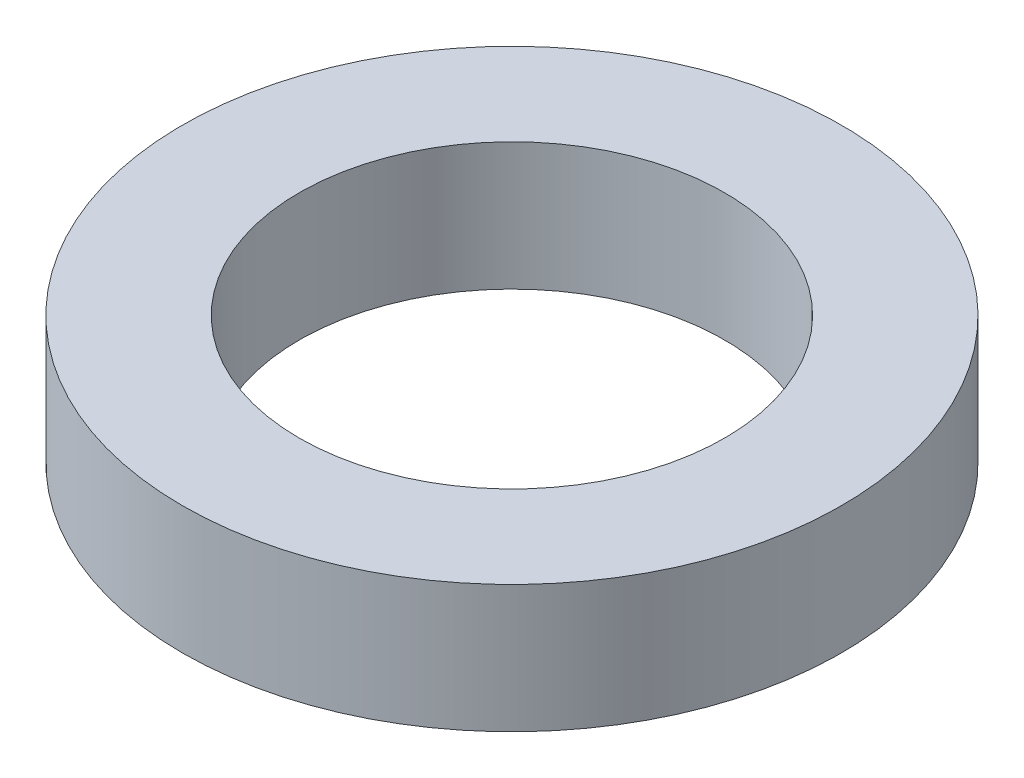
from build123d import *

# Parameters (mm, degrees)
SKETCH1_R           = 31
SKETCH1_R_2         = 20
BOSS_EXTRUDE1_DEPTH = 12


with BuildPart() as part:
    # Sketch1 → Boss-Extrude1 (new body)
    with BuildSketch(Plane(origin=(0, 0, 0), x_dir=(1, 0, 0), z_dir=(0, 1, 0))):
        with Locations(Location((0, 0, 0), (0, 0, 270))):
            Circle(SKETCH1_R)
        with Locations(Location((0, 0, 0), (0, 0, 270))):
            Circle(SKETCH1_R_2, mode=Mode.SUBTRACT)
    extrude(amount=BOSS_EXTRUDE1_DEPTH)


solid = part.part
